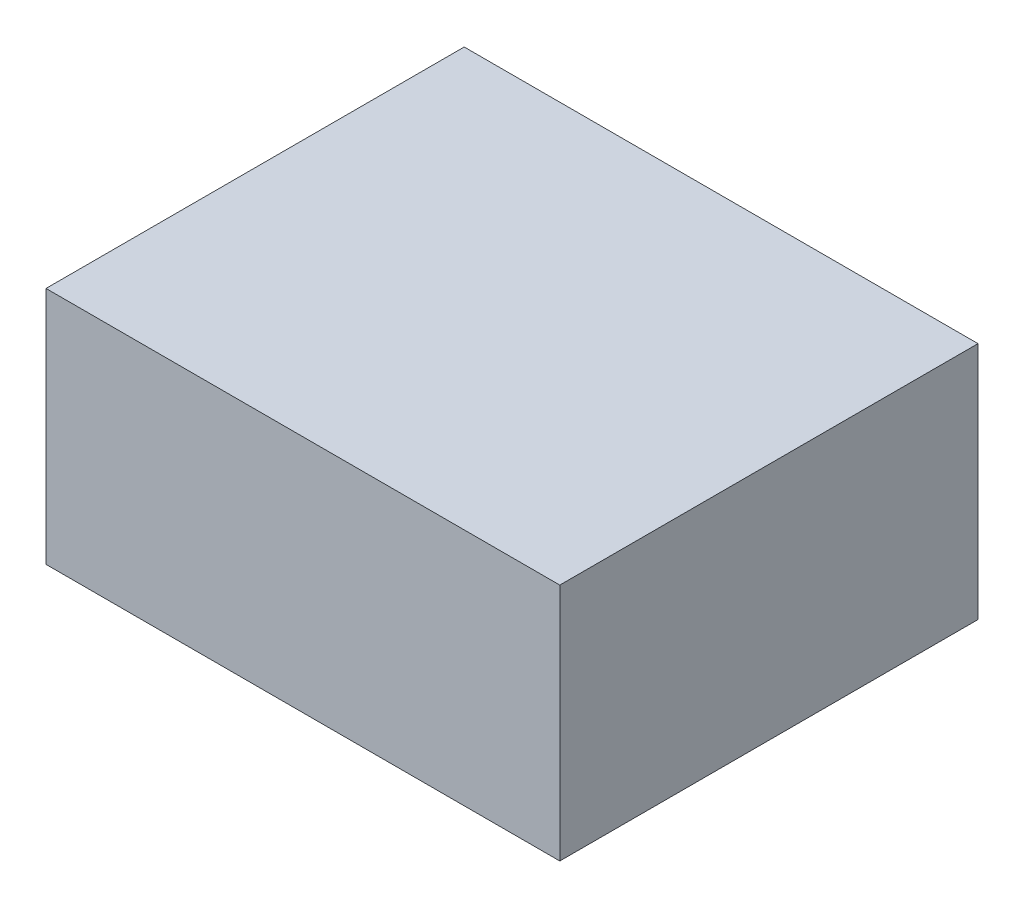
from build123d import *

# Parameters (mm, degrees)
SKETCH1_W           = 43
SKETCH1_H           = 35
BOSS_EXTRUDE2_DEPTH = 20


with BuildPart() as part:
    # Sketch1 → Boss-Extrude2 (new body)
    with BuildSketch(Plane(origin=(0, 0, 0), x_dir=(1, 0, 0), z_dir=(0, 1, 0))):
        with Locations((21.5, -17.5)):
            Rectangle(SKETCH1_W, SKETCH1_H)
    extrude(amount=BOSS_EXTRUDE2_DEPTH)


solid = part.part
